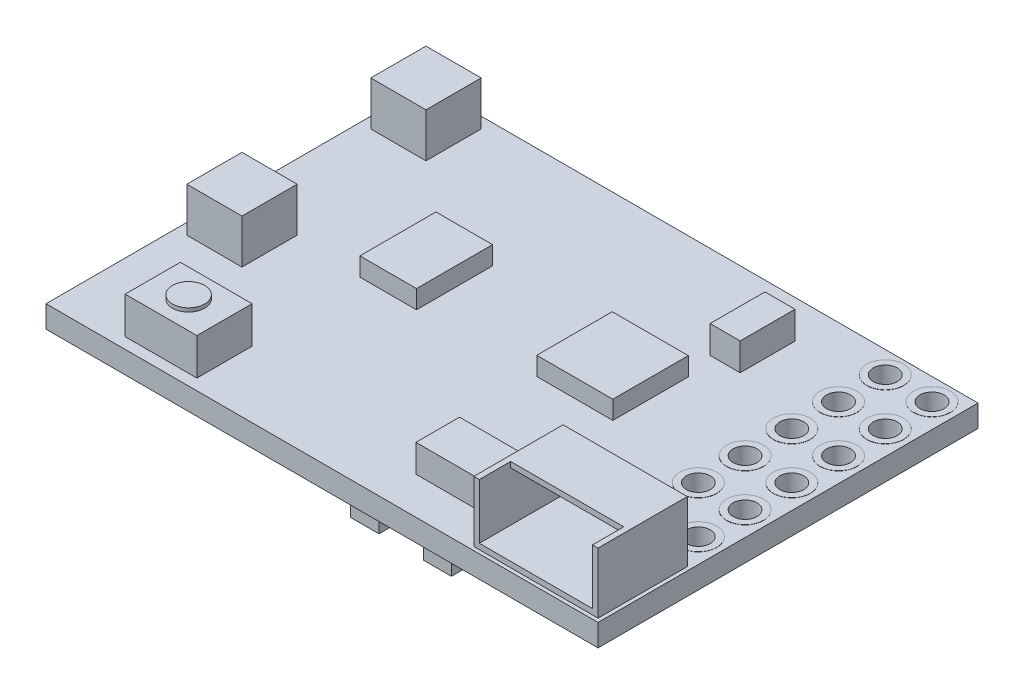
from build123d import *

# Parameters (mm, degrees)
SKETCH1_W           = 30
SKETCH1_H           = 20.65
BOSS_EXTRUDE1_DEPTH = 1.2
CUT_EXTRUDE1_REACH  = 20.25
SKETCH2_R           = 0.65
SKETCH3_W           = 6.75
SKETCH3_H           = 4.85
BOSS_EXTRUDE2_DEPTH = 3.3
SKETCH4_W           = 3
SKETCH4_H           = 3
BOSS_EXTRUDE3_DEPTH = 2.4
SKETCH5_W           = 3.9
SKETCH5_H           = 3
BOSS_EXTRUDE4_DEPTH = 2
SKETCH6_R           = 0.875
BOSS_EXTRUDE5_DEPTH = 0.2
SKETCH7_W           = 6.15
SKETCH7_H           = 1.7
CUT_EXTRUDE2_DEPTH  = 3
SKETCH8_W           = 6.15
SKETCH8_H           = 2.7
CUT_EXTRUDE3_DEPTH  = 2.85
SKETCH9_W           = 4.13358082
SKETCH9_H           = 4.101537558
SKETCH9_W_2         = 3.076153169
SKETCH9_H_2         = 4.13358082
BOSS_EXTRUDE6_DEPTH = 1
SKETCH10_W          = 1.634206371
SKETCH10_H          = 2.980023382
SKETCH10_W_2        = 4.454013442
SKETCH10_H_2        = 2.371201401
BOSS_EXTRUDE7_DEPTH = 1.5
SKETCH11_W          = 6.849678862
SKETCH11_H          = 6.849678863
SKETCH11_W_2        = 1.518707079
SKETCH11_H_2        = 3.006420134
SKETCH11_W_3        = 1.5497011
SKETCH11_H_3        = 3.068408178
SKETCH11_W_4        = 1.177772837
SKETCH11_H_4        = 2.758467958
SKETCH11_W_5        = 2.86022906
SKETCH11_H_5        = 4.18419297
SKETCH11_W_6        = 2.386539694
SKETCH11_H_6        = 3.0994022
SKETCH11_W_7        = 1.270754903
SKETCH11_H_7        = 3.161390244
BOSS_EXTRUDE8_DEPTH = 1.5
BOSS_EXTRUDE9_START = 0.01
SKETCH12_R          = 1
SKETCH12_R_2        = 0.65
BOSS_EXTRUDE9_DEPTH = 0.01


with BuildPart() as part:
    # Sketch1 → Boss-Extrude1 (new body)
    with BuildSketch(Plane(origin=(0, 0, 0), x_dir=(1, 0, 0), z_dir=(0, 1, 0))):
        Rectangle(SKETCH1_W, SKETCH1_H)
    extrude(amount=BOSS_EXTRUDE1_DEPTH)

    # Sketch2 → Cut-Extrude1 (cut, up to next)
    with BuildSketch(Plane(origin=(0, 1.2, 0), x_dir=(1, 0, 0), z_dir=(0, 1, 0)), mode=Mode.PRIVATE) as cut_extrude1_sk1:
        with Locations(Location((13.7, 9.125, 0), (0, 0, 270))):
            Circle(SKETCH2_R)
    cut_extrude1_tool1 = extrude(cut_extrude1_sk1.sketch, amount=-CUT_EXTRUDE1_REACH, mode=Mode.PRIVATE) & part.part
    # Sketch2 → Cut-Extrude1 (cut, up to next)
    with BuildSketch(Plane(origin=(0, 1.2, 0), x_dir=(1, 0, 0), z_dir=(0, 1, 0)), mode=Mode.PRIVATE) as cut_extrude1_sk2:
        with Locations(Location((11.16, 9.125, 0), (0, 0, 270))):
            Circle(SKETCH2_R)
    cut_extrude1_tool2 = extrude(cut_extrude1_sk2.sketch, amount=-CUT_EXTRUDE1_REACH, mode=Mode.PRIVATE) & part.part
    # Sketch2 → Cut-Extrude1 (cut, up to next)
    with BuildSketch(Plane(origin=(0, 1.2, 0), x_dir=(1, 0, 0), z_dir=(0, 1, 0)), mode=Mode.PRIVATE) as cut_extrude1_sk3:
        with Locations(Location((11.16, 6.585, 0), (0, 0, 270))):
            Circle(SKETCH2_R)
    cut_extrude1_tool3 = extrude(cut_extrude1_sk3.sketch, amount=-CUT_EXTRUDE1_REACH, mode=Mode.PRIVATE) & part.part
    # Sketch2 → Cut-Extrude1 (cut, up to next)
    with BuildSketch(Plane(origin=(0, 1.2, 0), x_dir=(1, 0, 0), z_dir=(0, 1, 0)), mode=Mode.PRIVATE) as cut_extrude1_sk4:
        with Locations(Location((11.16, 4.045, 0), (0, 0, 270))):
            Circle(SKETCH2_R)
    cut_extrude1_tool4 = extrude(cut_extrude1_sk4.sketch, amount=-CUT_EXTRUDE1_REACH, mode=Mode.PRIVATE) & part.part
    # Sketch2 → Cut-Extrude1 (cut, up to next)
    with BuildSketch(Plane(origin=(0, 1.2, 0), x_dir=(1, 0, 0), z_dir=(0, 1, 0)), mode=Mode.PRIVATE) as cut_extrude1_sk5:
        with Locations(Location((11.16, 1.505, 0), (0, 0, 270))):
            Circle(SKETCH2_R)
    cut_extrude1_tool5 = extrude(cut_extrude1_sk5.sketch, amount=-CUT_EXTRUDE1_REACH, mode=Mode.PRIVATE) & part.part
    # Sketch2 → Cut-Extrude1 (cut, up to next)
    with BuildSketch(Plane(origin=(0, 1.2, 0), x_dir=(1, 0, 0), z_dir=(0, 1, 0)), mode=Mode.PRIVATE) as cut_extrude1_sk6:
        with Locations(Location((11.16, -1.035, 0), (0, 0, 270))):
            Circle(SKETCH2_R)
    cut_extrude1_tool6 = extrude(cut_extrude1_sk6.sketch, amount=-CUT_EXTRUDE1_REACH, mode=Mode.PRIVATE) & part.part
    # Sketch2 → Cut-Extrude1 (cut, up to next)
    with BuildSketch(Plane(origin=(0, 1.2, 0), x_dir=(1, 0, 0), z_dir=(0, 1, 0)), mode=Mode.PRIVATE) as cut_extrude1_sk7:
        with Locations(Location((11.16, -3.575, 0), (0, 0, 270))):
            Circle(SKETCH2_R)
    cut_extrude1_tool7 = extrude(cut_extrude1_sk7.sketch, amount=-CUT_EXTRUDE1_REACH, mode=Mode.PRIVATE) & part.part
    # Sketch2 → Cut-Extrude1 (cut, up to next)
    with BuildSketch(Plane(origin=(0, 1.2, 0), x_dir=(1, 0, 0), z_dir=(0, 1, 0)), mode=Mode.PRIVATE) as cut_extrude1_sk8:
        with Locations(Location((13.7, 6.585, 0), (0, 0, 270))):
            Circle(SKETCH2_R)
    cut_extrude1_tool8 = extrude(cut_extrude1_sk8.sketch, amount=-CUT_EXTRUDE1_REACH, mode=Mode.PRIVATE) & part.part
    # Sketch2 → Cut-Extrude1 (cut, up to next)
    with BuildSketch(Plane(origin=(0, 1.2, 0), x_dir=(1, 0, 0), z_dir=(0, 1, 0)), mode=Mode.PRIVATE) as cut_extrude1_sk9:
        with Locations(Location((13.7, 4.045, 0), (0, 0, 270))):
            Circle(SKETCH2_R)
    cut_extrude1_tool9 = extrude(cut_extrude1_sk9.sketch, amount=-CUT_EXTRUDE1_REACH, mode=Mode.PRIVATE) & part.part
    # Sketch2 → Cut-Extrude1 (cut, up to next)
    with BuildSketch(Plane(origin=(0, 1.2, 0), x_dir=(1, 0, 0), z_dir=(0, 1, 0)), mode=Mode.PRIVATE) as cut_extrude1_sk10:
        with Locations(Location((13.7, 1.505, 0), (0, 0, 270))):
            Circle(SKETCH2_R)
    cut_extrude1_tool10 = extrude(cut_extrude1_sk10.sketch, amount=-CUT_EXTRUDE1_REACH, mode=Mode.PRIVATE) & part.part
    # Sketch2 → Cut-Extrude1 (cut, up to next)
    with BuildSketch(Plane(origin=(0, 1.2, 0), x_dir=(1, 0, 0), z_dir=(0, 1, 0)), mode=Mode.PRIVATE) as cut_extrude1_sk11:
        with Locations(Location((13.7, -1.035, 0), (0, 0, 270))):
            Circle(SKETCH2_R)
    cut_extrude1_tool11 = extrude(cut_extrude1_sk11.sketch, amount=-CUT_EXTRUDE1_REACH, mode=Mode.PRIVATE) & part.part
    # Sketch2 → Cut-Extrude1 (cut, up to next)
    with BuildSketch(Plane(origin=(0, 1.2, 0), x_dir=(1, 0, 0), z_dir=(0, 1, 0)), mode=Mode.PRIVATE) as cut_extrude1_sk12:
        with Locations(Location((13.7, -3.575, 0), (0, 0, 270))):
            Circle(SKETCH2_R)
    cut_extrude1_tool12 = extrude(cut_extrude1_sk12.sketch, amount=-CUT_EXTRUDE1_REACH, mode=Mode.PRIVATE) & part.part
    add(cut_extrude1_tool1.solids().sort_by_distance((13.7, 1.2, -9.125))[0], mode=Mode.SUBTRACT)
    add(cut_extrude1_tool2.solids().sort_by_distance((11.16, 1.2, -9.125))[0], mode=Mode.SUBTRACT)
    add(cut_extrude1_tool3.solids().sort_by_distance((11.16, 1.2, -6.585))[0], mode=Mode.SUBTRACT)
    add(cut_extrude1_tool4.solids().sort_by_distance((11.16, 1.2, -4.045))[0], mode=Mode.SUBTRACT)
    add(cut_extrude1_tool5.solids().sort_by_distance((11.16, 1.2, -1.505))[0], mode=Mode.SUBTRACT)
    add(cut_extrude1_tool6.solids().sort_by_distance((11.16, 1.2, 1.035))[0], mode=Mode.SUBTRACT)
    add(cut_extrude1_tool7.solids().sort_by_distance((11.16, 1.2, 3.575))[0], mode=Mode.SUBTRACT)
    add(cut_extrude1_tool8.solids().sort_by_distance((13.7, 1.2, -6.585))[0], mode=Mode.SUBTRACT)
    add(cut_extrude1_tool9.solids().sort_by_distance((13.7, 1.2, -4.045))[0], mode=Mode.SUBTRACT)
    add(cut_extrude1_tool10.solids().sort_by_distance((13.7, 1.2, -1.505))[0], mode=Mode.SUBTRACT)
    add(cut_extrude1_tool11.solids().sort_by_distance((13.7, 1.2, 1.035))[0], mode=Mode.SUBTRACT)
    add(cut_extrude1_tool12.solids().sort_by_distance((13.7, 1.2, 3.575))[0], mode=Mode.SUBTRACT)

    # Sketch3 → Boss-Extrude2 (add)
    with BuildSketch(Plane(origin=(0, 1.2, 0), x_dir=(1, 0, 0), z_dir=(0, 1, 0))):
        with Locations((11.425, -7.7)):
            Rectangle(SKETCH3_W, SKETCH3_H)
    extrude(amount=BOSS_EXTRUDE2_DEPTH)

    # Sketch4 → Boss-Extrude3 (add)
    with BuildSketch(Plane(origin=(0, 1.2, 0), x_dir=(1, 0, 0), z_dir=(0, 1, 0))):
        with Locations((-12.9, 8.225)):
            Rectangle(SKETCH4_W, SKETCH4_H)
        with Locations((-12.9, -1.775)):
            Rectangle(SKETCH4_W, SKETCH4_H)
    extrude(amount=BOSS_EXTRUDE3_DEPTH)

    # Sketch5 → Boss-Extrude4 (add)
    with BuildSketch(Plane(origin=(0, 1.2, 0), x_dir=(1, 0, 0), z_dir=(0, 1, 0))):
        with Locations((-9.35, -8.225)):
            Rectangle(SKETCH5_W, SKETCH5_H)
    extrude(amount=BOSS_EXTRUDE4_DEPTH)

    # Sketch6 → Boss-Extrude5 (add)
    with BuildSketch(Plane(origin=(0, 3.2, 0), x_dir=(1, 0, 0), z_dir=(0, 1, 0))):
        with Locations(Location((-9.35, -8.225, 0), (0, 0, 90))):
            Circle(SKETCH6_R)
    extrude(amount=BOSS_EXTRUDE5_DEPTH)

    # Sketch7 → Cut-Extrude2 (cut)
    with BuildSketch(Plane(origin=(0, 4.5, 0), x_dir=(1, 0, 0), z_dir=(0, 1, 0))):
        with Locations((11.425, -9.275)):
            Rectangle(SKETCH7_W, SKETCH7_H)
    extrude(amount=-CUT_EXTRUDE2_DEPTH, mode=Mode.SUBTRACT)

    # Sketch8 → Cut-Extrude3 (cut)
    with BuildSketch(Plane.XY.offset(8.425)):
        with Locations((11.425, 2.85)):
            Rectangle(SKETCH8_W, SKETCH8_H)
    extrude(amount=-CUT_EXTRUDE3_DEPTH, mode=Mode.SUBTRACT)

    # Sketch9 → Boss-Extrude6 (add)
    with BuildSketch(Plane(origin=(0, 1.2, 0), x_dir=(1, 0, 0), z_dir=(0, 1, 0))):
        with Locations((3.82916983, 1.634206371)):
            Rectangle(SKETCH9_W, SKETCH9_H)
        with Locations((-6.1843496, 1.522054953)):
            Rectangle(SKETCH9_W_2, SKETCH9_H_2)
    extrude(amount=BOSS_EXTRUDE6_DEPTH)

    # Sketch10 → Boss-Extrude7 (add)
    with BuildSketch(Plane(origin=(0, 1.2, 0), x_dir=(1, 0, 0), z_dir=(0, 1, 0))):
        with Locations((6.296501018, 6.77714995)):
            Rectangle(SKETCH10_W, SKETCH10_H)
        with Locations((5.30315989, -7.113604202)):
            Rectangle(SKETCH10_W_2, SKETCH10_H_2)
    extrude(amount=BOSS_EXTRUDE7_DEPTH)

    # Sketch11 → Boss-Extrude8 (add)
    with BuildSketch(Plane.XZ):
        with Locations((-2.928935079, -0.803882292)):
            Rectangle(SKETCH11_W, SKETCH11_H)
        with Locations((5.387348503, 7.936431913)):
            Rectangle(SKETCH11_W_2, SKETCH11_H_2)
        with Locations((1.404616675, 7.874443869)):
            Rectangle(SKETCH11_W_3, SKETCH11_H_3)
        with Locations((5.557815623, 4.248143295)):
            Rectangle(SKETCH11_W_4, SKETCH11_H_4)
        with Locations((-13.56988547, -6.475788318)):
            Rectangle(SKETCH11_W_5, SKETCH11_H_5)
        with Locations((-12.403220127, 2.249028876)):
            Rectangle(SKETCH11_W_6, SKETCH11_H_6)
        with Locations((-9.365805971, -7.886016319)):
            Rectangle(SKETCH11_W_7, SKETCH11_H_7)
    extrude(amount=BOSS_EXTRUDE8_DEPTH)

    # Sketch12 → Boss-Extrude9 (add)
    # profile 1 of 12: a face of its own
    with BuildSketch(Plane(origin=(0, 1.2, 0), x_dir=(1, 0, 0), z_dir=(0, 1, 0)).offset(BOSS_EXTRUDE9_START)):
        with Locations(Location((11.16, 9.125, 0), (0, 0, 90))):
            Circle(SKETCH12_R)
        with Locations(Location((11.16, 9.125, 0), (0, 0, 270))):
            Circle(SKETCH12_R_2, mode=Mode.SUBTRACT)
    # profile 2 of 12: a face of its own
    with BuildSketch(Plane(origin=(0, 1.2, 0), x_dir=(1, 0, 0), z_dir=(0, 1, 0)).offset(BOSS_EXTRUDE9_START)):
        with Locations(Location((13.7, 9.125, 0), (0, 0, 90))):
            Circle(SKETCH12_R)
        with Locations(Location((13.7, 9.125, 0), (0, 0, 270))):
            Circle(SKETCH12_R_2, mode=Mode.SUBTRACT)
    # profile 3 of 12: a face of its own
    with BuildSketch(Plane(origin=(0, 1.2, 0), x_dir=(1, 0, 0), z_dir=(0, 1, 0)).offset(BOSS_EXTRUDE9_START)):
        with Locations(Location((13.7, 6.585, 0), (0, 0, 90))):
            Circle(SKETCH12_R)
        with Locations(Location((13.7, 6.585, 0), (0, 0, 270))):
            Circle(SKETCH12_R_2, mode=Mode.SUBTRACT)
    # profile 4 of 12: a face of its own
    with BuildSketch(Plane(origin=(0, 1.2, 0), x_dir=(1, 0, 0), z_dir=(0, 1, 0)).offset(BOSS_EXTRUDE9_START)):
        with Locations(Location((11.16, 6.585, 0), (0, 0, 90))):
            Circle(SKETCH12_R)
        with Locations(Location((11.16, 6.585, 0), (0, 0, 270))):
            Circle(SKETCH12_R_2, mode=Mode.SUBTRACT)
    # profile 5 of 12: a face of its own
    with BuildSketch(Plane(origin=(0, 1.2, 0), x_dir=(1, 0, 0), z_dir=(0, 1, 0)).offset(BOSS_EXTRUDE9_START)):
        with Locations(Location((11.16, 4.045, 0), (0, 0, 90))):
            Circle(SKETCH12_R)
        with Locations(Location((11.16, 4.045, 0), (0, 0, 270))):
            Circle(SKETCH12_R_2, mode=Mode.SUBTRACT)
    # profile 6 of 12: a face of its own
    with BuildSketch(Plane(origin=(0, 1.2, 0), x_dir=(1, 0, 0), z_dir=(0, 1, 0)).offset(BOSS_EXTRUDE9_START)):
        with Locations(Location((13.7, 4.045, 0), (0, 0, 90))):
            Circle(SKETCH12_R)
        with Locations(Location((13.7, 4.045, 0), (0, 0, 270))):
            Circle(SKETCH12_R_2, mode=Mode.SUBTRACT)
    # profile 7 of 12: a face of its own
    with BuildSketch(Plane(origin=(0, 1.2, 0), x_dir=(1, 0, 0), z_dir=(0, 1, 0)).offset(BOSS_EXTRUDE9_START)):
        with Locations(Location((13.7, 1.505, 0), (0, 0, 90))):
            Circle(SKETCH12_R)
        with Locations(Location((13.7, 1.505, 0), (0, 0, 270))):
            Circle(SKETCH12_R_2, mode=Mode.SUBTRACT)
    # profile 8 of 12: a face of its own
    with BuildSketch(Plane(origin=(0, 1.2, 0), x_dir=(1, 0, 0), z_dir=(0, 1, 0)).offset(BOSS_EXTRUDE9_START)):
        with Locations(Location((11.16, 1.505, 0), (0, 0, 90))):
            Circle(SKETCH12_R)
        with Locations(Location((11.16, 1.505, 0), (0, 0, 270))):
            Circle(SKETCH12_R_2, mode=Mode.SUBTRACT)
    # profile 9 of 12: a face of its own
    with BuildSketch(Plane(origin=(0, 1.2, 0), x_dir=(1, 0, 0), z_dir=(0, 1, 0)).offset(BOSS_EXTRUDE9_START)):
        with Locations(Location((11.16, -1.035, 0), (0, 0, 90))):
            Circle(SKETCH12_R)
        with Locations(Location((11.16, -1.035, 0), (0, 0, 270))):
            Circle(SKETCH12_R_2, mode=Mode.SUBTRACT)
    # profile 10 of 12: a face of its own
    with BuildSketch(Plane(origin=(0, 1.2, 0), x_dir=(1, 0, 0), z_dir=(0, 1, 0)).offset(BOSS_EXTRUDE9_START)):
        with Locations(Location((11.16, -3.575, 0), (0, 0, 90))):
            Circle(SKETCH12_R)
        with Locations(Location((11.16, -3.575, 0), (0, 0, 270))):
            Circle(SKETCH12_R_2, mode=Mode.SUBTRACT)
    # profile 11 of 12: a face of its own
    with BuildSketch(Plane(origin=(0, 1.2, 0), x_dir=(1, 0, 0), z_dir=(0, 1, 0)).offset(BOSS_EXTRUDE9_START)):
        with Locations(Location((13.7, -3.575, 0), (0, 0, 90))):
            Circle(SKETCH12_R)
        with Locations(Location((13.7, -3.575, 0), (0, 0, 270))):
            Circle(SKETCH12_R_2, mode=Mode.SUBTRACT)
    # profile 12 of 12: a face of its own
    with BuildSketch(Plane(origin=(0, 1.2, 0), x_dir=(1, 0, 0), z_dir=(0, 1, 0)).offset(BOSS_EXTRUDE9_START)):
        with Locations(Location((13.7, -1.035, 0), (0, 0, 90))):
            Circle(SKETCH12_R)
        with Locations(Location((13.7, -1.035, 0), (0, 0, 270))):
            Circle(SKETCH12_R_2, mode=Mode.SUBTRACT)
    boss_extrude9 = extrude(amount=-BOSS_EXTRUDE9_DEPTH)

    # Mirror1: Boss-Extrude9 across plane
    add(boss_extrude9.mirror(Plane.ZX.offset(0.6)))


solid = part.part
